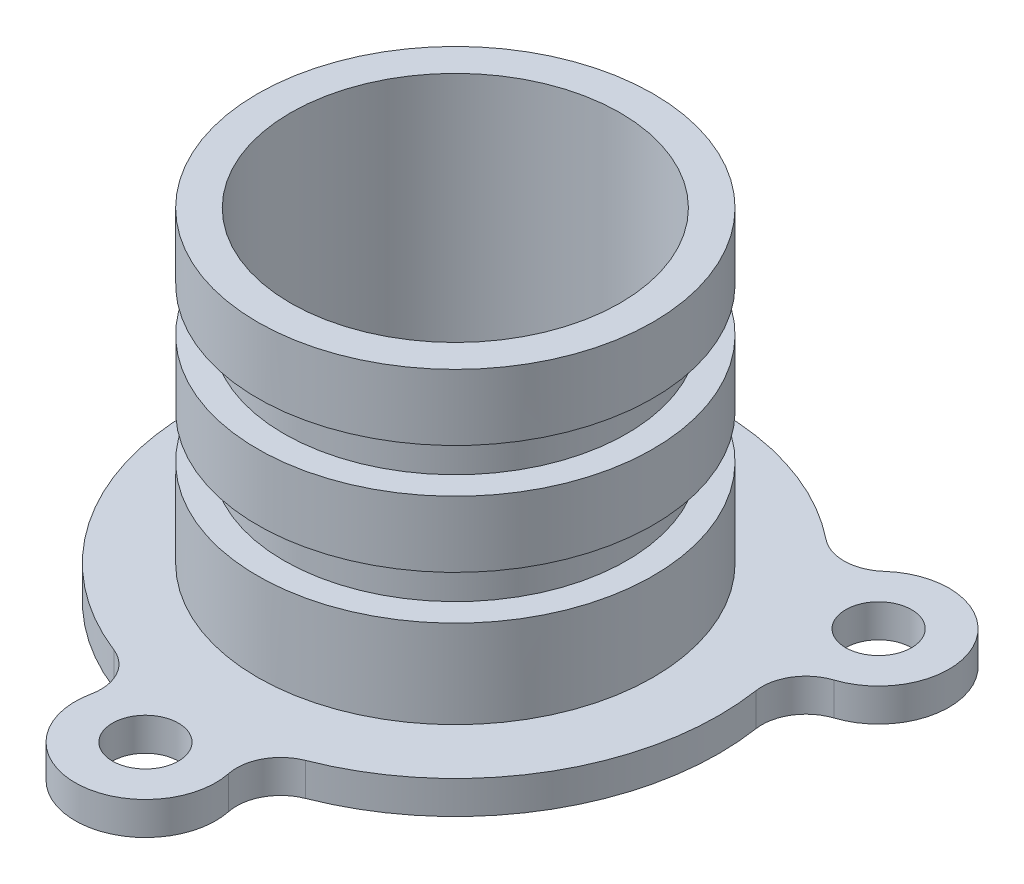
from build123d import *

# Parameters (mm, degrees)
SKETCH1_R           = 7.5
BOSS_EXTRUDE1_DEPTH = 7.5
SKETCH2_R           = 45
BOSS_EXTRUDE2_DEPTH = 70
SKETCH3_W           = 6
SKETCH3_H           = 10
HOLE1_D             = 75


with BuildPart() as part:
    # Sketch1 → Boss-Extrude1 (new body)
    with BuildSketch(Plane(origin=(0, 0, 0), x_dir=(1, 0, 0), z_dir=(0, 1, 0))):
        with BuildLine():
            ThreePointArc((21.819107759, -55.892097264), (51.961524227, -30), (59.313529981, 9.050147025))
            ThreePointArc((59.313529981, 9.050147025), (60.675902532, 15.788685813), (66.066684717, 20.055233762))
            ThreePointArc((66.066684717, 20.055233762), (74.911197427, 43.25), (50.401684275, 47.187810428))
            ThreePointArc((50.401684275, 47.187810428), (44.011354273, 44.652530083), (37.494422222, 46.841950239))
            ThreePointArc((37.494422222, 46.841950239), (0, 60), (-37.494422222, 46.841950239))
            ThreePointArc((-37.494422222, 46.841950239), (-44.011354273, 44.652530083), (-50.401684275, 47.187810428))
            ThreePointArc((-50.401684275, 47.187810428), (-74.911197427, 43.25), (-66.066684717, 20.055233762))
            ThreePointArc((-66.066684717, 20.055233762), (-60.675902532, 15.788685813), (-59.313529981, 9.050147025))
            ThreePointArc((-59.313529981, 9.050147025), (-51.961524227, -30), (-21.819107759, -55.892097264))
            ThreePointArc((-21.819107759, -55.892097264), (-16.664548259, -60.441215897), (-15.665000442, -67.24304419))
            ThreePointArc((-15.665000442, -67.24304419), (0, -86.5), (15.665000442, -67.24304419))
            ThreePointArc((15.665000442, -67.24304419), (16.664548259, -60.441215897), (21.819107759, -55.892097264))
        make_face()
        with Locations(Location((-61.054790967, 35.25, 0), (0, 0, 270))):
            Circle(SKETCH1_R, mode=Mode.SUBTRACT)
        with Locations(Location((61.054790967, 35.25, 0), (0, 0, 270))):
            Circle(SKETCH1_R, mode=Mode.SUBTRACT)
        with Locations(Location((0, -70.5, 0), (0, 0, 270))):
            Circle(SKETCH1_R, mode=Mode.SUBTRACT)
    extrude(amount=BOSS_EXTRUDE1_DEPTH)

    # Sketch2 → Boss-Extrude2 (add)
    with BuildSketch(Plane(origin=(0, 7.5, 0), x_dir=(1, 0, 0), z_dir=(0, 1, 0))):
        with Locations(Location((0, 0, 0), (0, 0, 270))):
            Circle(SKETCH2_R)
    extrude(amount=BOSS_EXTRUDE2_DEPTH)

    # Sketch3 → Cut-Revolve2 (revolve, cut)
    with BuildSketch(Plane.XY, mode=Mode.PRIVATE) as cut_revolve2_sk:
        with Locations((42, 57.5)):
            Rectangle(SKETCH3_W, SKETCH3_H)
        with Locations((42, 32.5)):
            Rectangle(SKETCH3_W, SKETCH3_H)
    revolve(cut_revolve2_sk.sketch.rotate(Axis((0, 0, 0), (0, 1, 0)), 90), axis=Axis((0, 0, 0), (0, 1, 0)), mode=Mode.SUBTRACT)

    # Hole1 (through all)
    with Locations(Plane(origin=(0, 77.5, 0), x_dir=(1, 0, 0), z_dir=(0, 1, 0))):
        with Locations((0, 0)):
            Hole(HOLE1_D / 2)


solid = part.part
